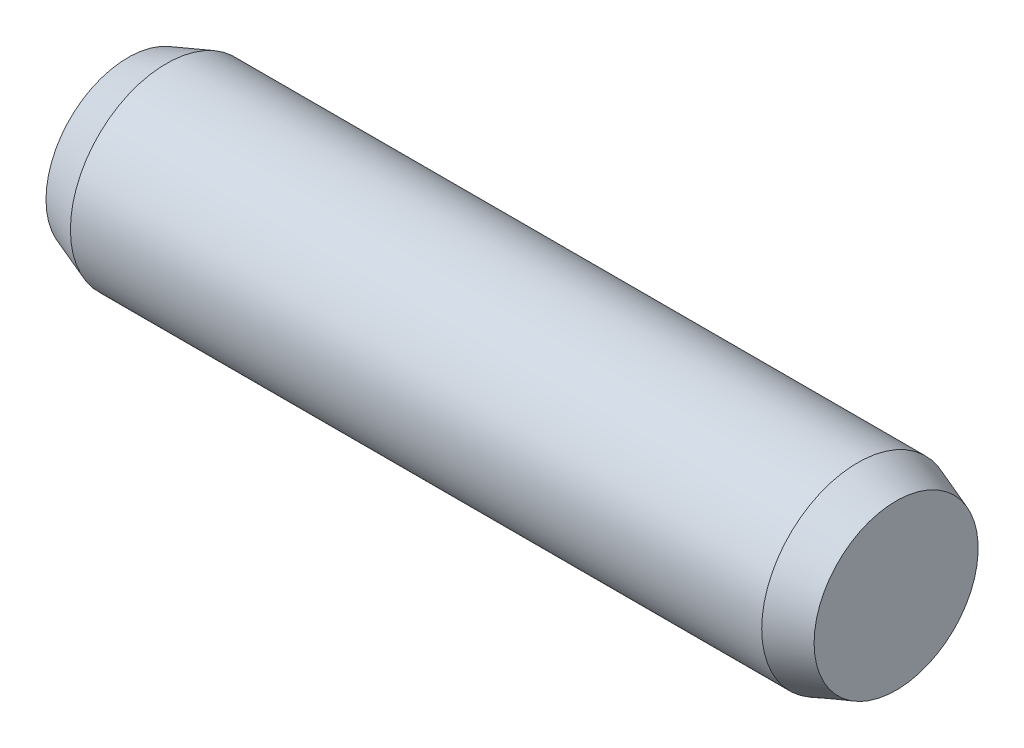
from build123d import *


with BuildPart() as part:
    # Эскиз1 → Повернуть1 (revolve)
    with BuildSketch(Plane.XY, mode=Mode.PRIVATE) as revolve_1_sk:
        Polygon((0, 0), (0, 1.281617859), (0.6, 1.5), (11.4, 1.5), (12, 1.281617859), (12, 0), align=None)
    revolve(revolve_1_sk.sketch.rotate(Axis((0, 0, 0), (1, 0, 0)), 90), axis=Axis((0, 0, 0), (1, 0, 0)))


solid = part.part
